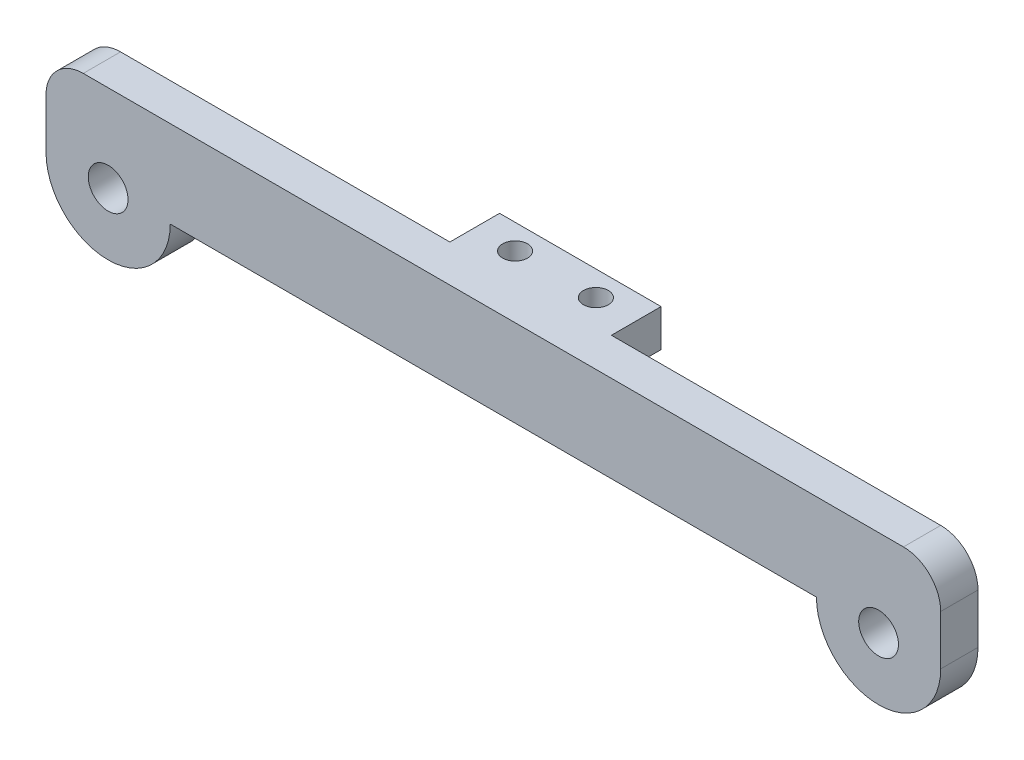
from build123d import *

# Parameters (mm, degrees)
SKETCH_1_R      = 1.6
EXTRUDE_1_DEPTH = 3
SKETCH_6_W      = 13
SKETCH_6_H      = 4
SKETCH_6_R      = 1
EXTRUDE_3_DEPTH = 3
FILLET_1_R      = 3


with BuildPart() as part:
    # ｽｹｯﾁ1 → ﾎﾞｽ - 押し出し1 (new body)
    with BuildSketch(Plane.XY):
        with BuildLine():
            Line((-26, 0), (26, 0))
            ThreePointArc((26, 0), (31, -5), (36, 0))
            Line((36, 0), (36, 7))
            Line((36, 7), (-36, 7))
            Line((-36, 7), (-36, 0))
            ThreePointArc((-36, 0), (-31, -5), (-26, 0))
        make_face()
        with Locations((-31, 0)):
            Circle(SKETCH_1_R, mode=Mode.SUBTRACT)
        with Locations((31, 0)):
            Circle(SKETCH_1_R, mode=Mode.SUBTRACT)
    extrude(amount=EXTRUDE_1_DEPTH)

    # ｽｹｯﾁ6 → ﾎﾞｽ - 押し出し3 (add)
    with BuildSketch(Plane(origin=(0, 7, 0), x_dir=(1, 0, 0), z_dir=(0, 1, 0))):
        with Locations((0, 2)):
            Rectangle(SKETCH_6_W, SKETCH_6_H)
        with Locations(Location((-3.25, 2, 0), (0, 0, 180))):
            Circle(SKETCH_6_R, mode=Mode.SUBTRACT)
        with Locations(Location((3.25, 2, 0), (0, 0, 180))):
            Circle(SKETCH_6_R, mode=Mode.SUBTRACT)
    extrude(amount=-EXTRUDE_3_DEPTH)

    # ﾌｨﾚｯﾄ1
    fillet_1_edges = [part.edges().sort_by_distance(p)[0] for p in [
        (-36, 7, 1.5),
        (36, 7, 1.5),
    ]]
    fillet(fillet_1_edges, radius=FILLET_1_R)


solid = part.part
